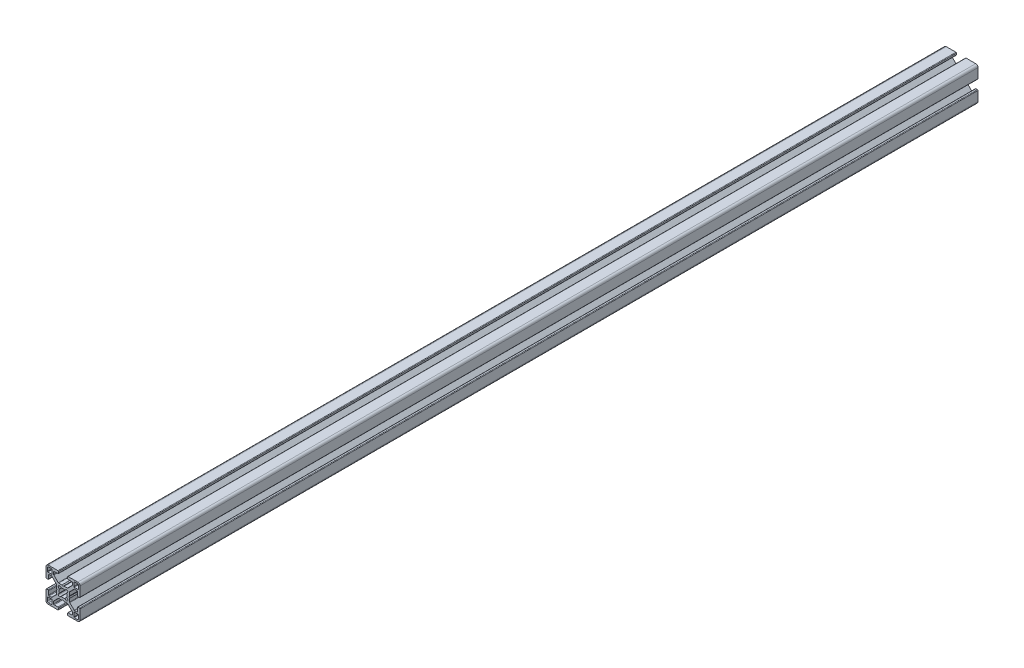
from build123d import *

# Parameters (mm, degrees)
EXTRUSION1_DEPTH = 792


with BuildPart() as part:
    # Esboço1 → Extrusion1 (new body)
    with BuildSketch(Plane.XY):
        with BuildLine():
            Line((-13, -15), (-4.508, -15))
            ThreePointArc((-4.508, -15), (-4.148789755, -14.851210245), (-4, -14.492))
            Line((-4, -14.492), (-4, -13.251))
            ThreePointArc((-4, -13.251), (-4.148789755, -12.891789755), (-4.508, -12.743))
            Line((-4.508, -12.743), (-7.742, -12.743))
            ThreePointArc((-7.742, -12.743), (-8.101210245, -12.594210245), (-8.25, -12.235))
            Line((-8.25, -12.235), (-8.25, -10.264165074))
            ThreePointArc((-8.25, -10.264165074), (-8.211330803, -10.06976189), (-8.101210245, -9.904954829))
            Line((-8.101210245, -9.904954829), (-4.179545171, -5.983289755))
            ThreePointArc((-4.179545171, -5.983289755), (-4.01473811, -5.873169197), (-3.820334926, -5.8345))
            Line((-3.820334926, -5.8345), (-0.949019985, -5.8345))
            Line((-0.949019985, -5.8345), (0, -5.325))
            Line((0, -5.325), (0.949019985, -5.8345))
            Line((0.949019985, -5.8345), (3.82157951, -5.8345))
            ThreePointArc((3.82157951, -5.8345), (4.015982694, -5.873169197), (4.180789755, -5.983289755))
            Line((4.180789755, -5.983289755), (8.101210245, -9.903710245))
            ThreePointArc((8.101210245, -9.903710245), (8.211330803, -10.068517306), (8.25, -10.26292049))
            Line((8.25, -10.26292049), (8.25, -12.235))
            ThreePointArc((8.25, -12.235), (8.101210245, -12.594210245), (7.742, -12.743))
            Line((7.742, -12.743), (4.508, -12.743))
            ThreePointArc((4.508, -12.743), (4.148789755, -12.891789755), (4, -13.251))
            Line((4, -13.251), (4, -14.492))
            ThreePointArc((4, -14.492), (4.148789755, -14.851210245), (4.508, -15))
            Line((4.508, -15), (13, -15))
            ThreePointArc((13, -15), (14.414213562, -14.414213562), (15, -13))
            Line((15, -13), (15, -4.508))
            ThreePointArc((15, -4.508), (14.851210245, -4.148789755), (14.492, -4))
            Line((14.492, -4), (13.251, -4))
            ThreePointArc((13.251, -4), (12.891789755, -4.148789755), (12.743, -4.508))
            Line((12.743, -4.508), (12.743, -7.742))
            ThreePointArc((12.743, -7.742), (12.594210245, -8.101210245), (12.235, -8.25))
            Line((12.235, -8.25), (10.264165074, -8.25))
            ThreePointArc((10.264165074, -8.25), (10.06976189, -8.211330803), (9.904954829, -8.101210245))
            Line((9.904954829, -8.101210245), (5.983289755, -4.179545171))
            ThreePointArc((5.983289755, -4.179545171), (5.873169197, -4.01473811), (5.8345, -3.820334926))
            Line((5.8345, -3.820334926), (5.8345, -0.949019985))
            Line((5.8345, -0.949019985), (5.325, 0))
            Line((5.325, 0), (5.8345, 0.949019985))
            Line((5.8345, 0.949019985), (5.8345, 3.82157951))
            ThreePointArc((5.8345, 3.82157951), (5.873169197, 4.015982694), (5.983289755, 4.180789755))
            Line((5.983289755, 4.180789755), (9.903710245, 8.101210245))
            ThreePointArc((9.903710245, 8.101210245), (10.068517306, 8.211330803), (10.26292049, 8.25))
            Line((10.26292049, 8.25), (12.235, 8.25))
            ThreePointArc((12.235, 8.25), (12.594210245, 8.101210245), (12.743, 7.742))
            Line((12.743, 7.742), (12.743, 4.508))
            ThreePointArc((12.743, 4.508), (12.891789755, 4.148789755), (13.251, 4))
            Line((13.251, 4), (14.492, 4))
            ThreePointArc((14.492, 4), (14.851210245, 4.148789755), (15, 4.508))
            Line((15, 4.508), (15, 13))
            ThreePointArc((15, 13), (14.414213562, 14.414213562), (13, 15))
            Line((13, 15), (4.508, 15))
            ThreePointArc((4.508, 15), (4.148789755, 14.851210245), (4, 14.492))
            Line((4, 14.492), (4, 13.251))
            ThreePointArc((4, 13.251), (4.148789755, 12.891789755), (4.508, 12.743))
            Line((4.508, 12.743), (7.742, 12.743))
            ThreePointArc((7.742, 12.743), (8.101210245, 12.594210245), (8.25, 12.235))
            Line((8.25, 12.235), (8.25, 10.264165074))
            ThreePointArc((8.25, 10.264165074), (8.211330803, 10.06976189), (8.101210245, 9.904954829))
            Line((8.101210245, 9.904954829), (4.179545171, 5.983289755))
            ThreePointArc((4.179545171, 5.983289755), (4.01473811, 5.873169197), (3.820334926, 5.8345))
            Line((3.820334926, 5.8345), (0.949019985, 5.8345))
            Line((0.949019985, 5.8345), (0, 5.325))
            Line((0, 5.325), (-0.949019985, 5.8345))
            Line((-0.949019985, 5.8345), (-3.82157951, 5.8345))
            ThreePointArc((-3.82157951, 5.8345), (-4.015982694, 5.873169197), (-4.180789755, 5.983289755))
            Line((-4.180789755, 5.983289755), (-8.101210245, 9.903710245))
            ThreePointArc((-8.101210245, 9.903710245), (-8.211330803, 10.068517306), (-8.25, 10.26292049))
            Line((-8.25, 10.26292049), (-8.25, 12.235))
            ThreePointArc((-8.25, 12.235), (-8.101210245, 12.594210245), (-7.742, 12.743))
            Line((-7.742, 12.743), (-4.508, 12.743))
            ThreePointArc((-4.508, 12.743), (-4.148789755, 12.891789755), (-4, 13.251))
            Line((-4, 13.251), (-4, 14.492))
            ThreePointArc((-4, 14.492), (-4.148789755, 14.851210245), (-4.508, 15))
            Line((-4.508, 15), (-13, 15))
            ThreePointArc((-13, 15), (-14.414213562, 14.414213562), (-15, 13))
            Line((-15, 13), (-15, 4.508))
            ThreePointArc((-15, 4.508), (-14.851210245, 4.148789755), (-14.492, 4))
            Line((-14.492, 4), (-13.251, 4))
            ThreePointArc((-13.251, 4), (-12.891789755, 4.148789755), (-12.743, 4.508))
            Line((-12.743, 4.508), (-12.743, 7.742))
            ThreePointArc((-12.743, 7.742), (-12.594210245, 8.101210245), (-12.235, 8.25))
            Line((-12.235, 8.25), (-10.264165074, 8.25))
            ThreePointArc((-10.264165074, 8.25), (-10.06976189, 8.211330803), (-9.904954829, 8.101210245))
            Line((-9.904954829, 8.101210245), (-5.983289755, 4.179545171))
            ThreePointArc((-5.983289755, 4.179545171), (-5.873169197, 4.01473811), (-5.8345, 3.820334926))
            Line((-5.8345, 3.820334926), (-5.8345, 0.949019985))
            Line((-5.8345, 0.949019985), (-5.325, 0))
            Line((-5.325, 0), (-5.8345, -0.949019985))
            Line((-5.8345, -0.949019985), (-5.8345, -3.82157951))
            ThreePointArc((-5.8345, -3.82157951), (-5.873169197, -4.015982694), (-5.983289755, -4.180789755))
            Line((-5.983289755, -4.180789755), (-9.903710245, -8.101210245))
            ThreePointArc((-9.903710245, -8.101210245), (-10.068517306, -8.211330803), (-10.26292049, -8.25))
            Line((-10.26292049, -8.25), (-12.235, -8.25))
            ThreePointArc((-12.235, -8.25), (-12.594210245, -8.101210245), (-12.743, -7.742))
            Line((-12.743, -7.742), (-12.743, -4.508))
            ThreePointArc((-12.743, -4.508), (-12.891789755, -4.148789755), (-13.251, -4))
            Line((-13.251, -4), (-14.492, -4))
            ThreePointArc((-14.492, -4), (-14.851210245, -4.148789755), (-15, -4.508))
            Line((-15, -4.508), (-15, -13))
            ThreePointArc((-15, -13), (-14.414213562, -14.414213562), (-13, -15))
        make_face()
        with BuildLine():
            Line((9.5, 13.319), (9.5, 9.881))
            ThreePointArc((9.5, 9.881), (9.611592316, 9.611592316), (9.881, 9.5))
            Line((9.881, 9.5), (13.319, 9.5))
            ThreePointArc((13.319, 9.5), (13.588407684, 9.611592316), (13.7, 9.881))
            Line((13.7, 9.881), (13.7, 12.7))
            ThreePointArc((13.7, 12.7), (13.407106781, 13.407106781), (12.7, 13.7))
            Line((12.7, 13.7), (9.881, 13.7))
            ThreePointArc((9.881, 13.7), (9.611592316, 13.588407684), (9.5, 13.319))
        make_face(mode=Mode.SUBTRACT)
        with BuildLine():
            Line((9.5, -9.881), (9.5, -13.319))
            ThreePointArc((9.5, -13.319), (9.611592316, -13.588407684), (9.881, -13.7))
            Line((9.881, -13.7), (12.7, -13.7))
            ThreePointArc((12.7, -13.7), (13.407106781, -13.407106781), (13.7, -12.7))
            Line((13.7, -12.7), (13.7, -9.881))
            ThreePointArc((13.7, -9.881), (13.588407684, -9.611592316), (13.319, -9.5))
            Line((13.319, -9.5), (9.881, -9.5))
            ThreePointArc((9.881, -9.5), (9.611592316, -9.611592316), (9.5, -9.881))
        make_face(mode=Mode.SUBTRACT)
        with BuildLine():
            Line((-13.7, -9.881), (-13.7, -12.7))
            ThreePointArc((-13.7, -12.7), (-13.407106781, -13.407106781), (-12.7, -13.7))
            Line((-12.7, -13.7), (-9.881, -13.7))
            ThreePointArc((-9.881, -13.7), (-9.611592316, -13.588407684), (-9.5, -13.319))
            Line((-9.5, -13.319), (-9.5, -9.881))
            ThreePointArc((-9.5, -9.881), (-9.611592316, -9.611592316), (-9.881, -9.5))
            Line((-9.881, -9.5), (-13.319, -9.5))
            ThreePointArc((-13.319, -9.5), (-13.588407684, -9.611592316), (-13.7, -9.881))
        make_face(mode=Mode.SUBTRACT)
        with BuildLine():
            Line((-13.7, 12.7), (-13.7, 9.881))
            ThreePointArc((-13.7, 9.881), (-13.588407684, 9.611592316), (-13.319, 9.5))
            Line((-13.319, 9.5), (-9.881, 9.5))
            ThreePointArc((-9.881, 9.5), (-9.611592316, 9.611592316), (-9.5, 9.881))
            Line((-9.5, 9.881), (-9.5, 13.319))
            ThreePointArc((-9.5, 13.319), (-9.611592316, 13.588407684), (-9.881, 13.7))
            Line((-9.881, 13.7), (-12.7, 13.7))
            ThreePointArc((-12.7, 13.7), (-13.407106781, 13.407106781), (-13.7, 12.7))
        make_face(mode=Mode.SUBTRACT)
        with BuildLine():
            Line((-4.010726841, 2.5139095), (-3.198163609, 1.494205317))
            ThreePointArc((-3.198163609, 1.494205317), (-3.53, 0), (-3.198163609, -1.494205317))
            Line((-3.198163609, -1.494205317), (-4.010726841, -2.5139095))
            ThreePointArc((-4.010726841, -2.5139095), (-3.900018469, -3.900018469), (-2.5139095, -4.010726841))
            Line((-2.5139095, -4.010726841), (-1.494205317, -3.198163609))
            ThreePointArc((-1.494205317, -3.198163609), (0, -3.53), (1.494205317, -3.198163609))
            Line((1.494205317, -3.198163609), (2.5139095, -4.010726841))
            ThreePointArc((2.5139095, -4.010726841), (3.900018469, -3.900018469), (4.010726841, -2.5139095))
            Line((4.010726841, -2.5139095), (3.198163609, -1.494205317))
            ThreePointArc((3.198163609, -1.494205317), (3.53, 0), (3.198163609, 1.494205317))
            Line((3.198163609, 1.494205317), (4.010726841, 2.5139095))
            ThreePointArc((4.010726841, 2.5139095), (3.900018469, 3.900018469), (2.5139095, 4.010726841))
            Line((2.5139095, 4.010726841), (1.494205317, 3.198163609))
            ThreePointArc((1.494205317, 3.198163609), (0, 3.53), (-1.494205317, 3.198163609))
            Line((-1.494205317, 3.198163609), (-2.5139095, 4.010726841))
            ThreePointArc((-2.5139095, 4.010726841), (-3.900018469, 3.900018469), (-4.010726841, 2.5139095))
        make_face(mode=Mode.SUBTRACT)
    extrude(amount=-EXTRUSION1_DEPTH)


solid = part.part
